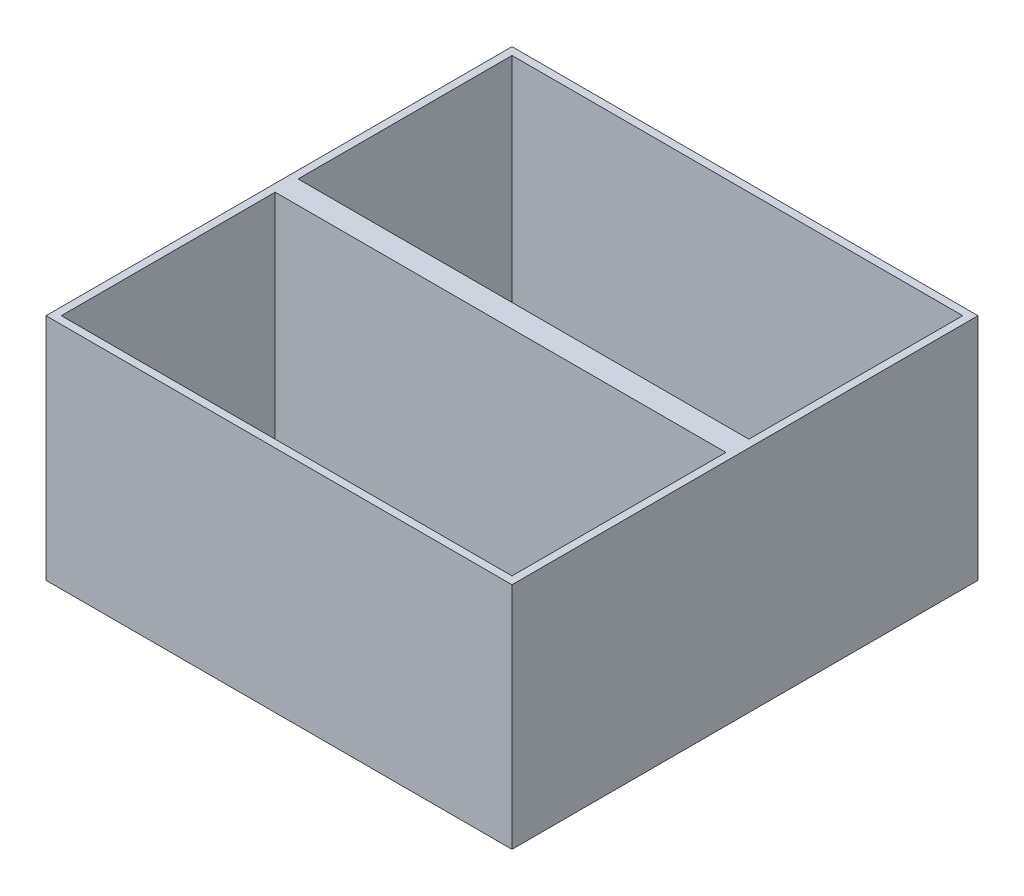
from build123d import *

# Parameters (mm, degrees)
SKETCH_1_W      = 305
SKETCH_1_H      = 305
SKETCH_1_W_2    = 295
SKETCH_1_H_2    = 295
EXTRUDE_1_DEPTH = 150
SKETCH_2_W      = 295
SKETCH_2_H      = 15
EXTRUDE_2_DEPTH = 150


with BuildPart() as part:
    # 草图1 → 拉伸-薄壁1 (new body)
    with BuildSketch(Plane(origin=(0, 0, 0), x_dir=(1, 0, 0), z_dir=(0, 1, 0))):
        with Locations((150, 150)):
            Rectangle(SKETCH_1_W, SKETCH_1_H)
        with Locations((150, 150)):
            Rectangle(SKETCH_1_W_2, SKETCH_1_H_2, mode=Mode.SUBTRACT)
    extrude(amount=EXTRUDE_1_DEPTH)

    # 草图2 → 拉伸-薄壁2 (add)
    with BuildSketch(Plane(origin=(0, 0, 0), x_dir=(1, 0, 0), z_dir=(0, 1, 0))):
        with Locations((150, 150)):
            Rectangle(SKETCH_2_W, SKETCH_2_H)
    extrude(amount=EXTRUDE_2_DEPTH)


solid = part.part
